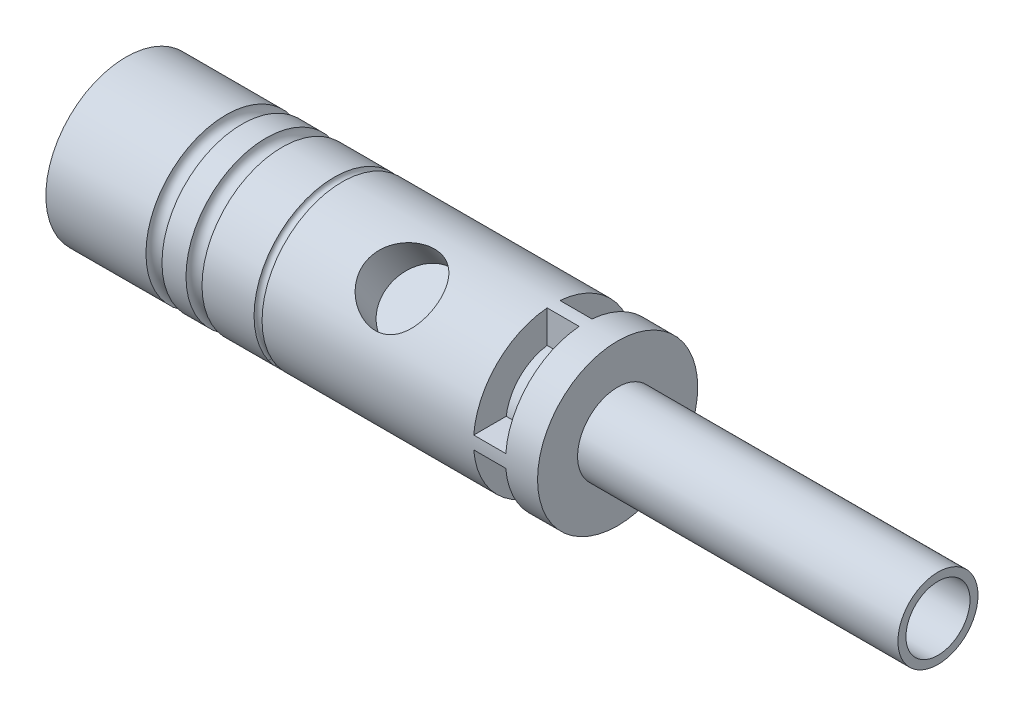
from build123d import *

# Parameters (mm, degrees)
SKETCH1_R           = 12.7
BOSS_EXTRUDE1_DEPTH = 38.989
SKETCH2_R           = 6.35
BOSS_EXTRUDE2_DEPTH = 50.8
SKETCH5_R           = 5.08
CUT_EXTRUDE1_DEPTH  = 50.8
SKETCH6_R           = 11.938
CUT_EXTRUDE2_DEPTH  = 11.684
SKETCH7_R           = 1.27
BOSS_EXTRUDE4_DEPTH = 6.35
SKETCH10_R          = 5.715
CUT_EXTRUDE3_DEPTH  = 7.62
SKETCH11_R          = 2.306564876
CUT_EXTRUDE4_DEPTH  = 92.567704602
CUT_EXTRUDE5_DEPTH  = 5.08
CIRPATTERN1_COUNT   = 4
SKETCH14_R          = 1.27
SKETCH14_R_2        = 0.635


with BuildPart() as part:
    # Sketch1 → Boss-Extrude1 (new, symmetric)
    with BuildSketch(Plane(origin=(0, 0, 0), x_dir=(0, 0, -1), z_dir=(1, 0, 0))):
        Circle(SKETCH1_R)
    extrude(amount=BOSS_EXTRUDE1_DEPTH, both=True)

    # Sketch2 → Boss-Extrude2 (add)
    with BuildSketch(Plane(origin=(38.989, 0, 0), x_dir=(0, 0, -1), z_dir=(1, 0, 0))):
        Circle(SKETCH2_R)
    extrude(amount=BOSS_EXTRUDE2_DEPTH)

    # Sketch5 → Cut-Extrude1 (cut)
    with BuildSketch(Plane(origin=(89.789, 0, 0), x_dir=(0, 0, -1), z_dir=(1, 0, 0))):
        Circle(SKETCH5_R)
    extrude(amount=-CUT_EXTRUDE1_DEPTH, mode=Mode.SUBTRACT)

    # Sketch6 → Cut-Extrude2 (cut)
    with BuildSketch(Plane.ZY.offset(38.989)):
        Circle(SKETCH6_R)
    extrude(amount=-CUT_EXTRUDE2_DEPTH, mode=Mode.SUBTRACT)

    # Sketch7 → Boss-Extrude4 (add)
    with BuildSketch(Plane.ZY.offset(27.305)):
        Circle(SKETCH7_R)
    extrude(amount=BOSS_EXTRUDE4_DEPTH)

    # Sketch10 → Cut-Extrude3 (cut)
    with BuildSketch(Plane(origin=(0, 11.528802792, 8.001614114), x_dir=(1, 0, 0), z_dir=(0, 0.8215201333891482, 0.5701795072047716))):
        with Locations(Location((11.73200505, 0, 0), (0, 0, 270))):
            Circle(SKETCH10_R)
    extrude(amount=-CUT_EXTRUDE3_DEPTH, mode=Mode.SUBTRACT)

    # Sketch11 → Cut-Extrude4 (cut, through all)
    with BuildSketch(Plane(origin=(0, 0, 0), x_dir=(1, 0, 0), z_dir=(0, -0.5701795072047716, 0.8215201333891482))):
        with Locations(Location((16.023991034, 0, 0), (0, 0, 270))):
            Circle(SKETCH11_R)
        with Locations(Location((-9.873377059, 0, 0), (0, 0, 270))):
            Circle(SKETCH11_R)
    extrude(amount=-CUT_EXTRUDE4_DEPTH, mode=Mode.SUBTRACT)

    # Sketch13 → Cut-Extrude5 (cut)
    with BuildSketch(Plane(origin=(33.909, 0, 0), x_dir=(0, 0, -1), z_dir=(1, 0, 0))):
        with BuildLine():
            Line((1.016, 7.50672894), (1.016, 13.505826979))
            ThreePointArc((1.016, 13.505826979), (9.577045953, 9.577045953), (13.505826979, 1.016))
            Line((13.505826979, 1.016), (7.50672894, 1.016))
            ThreePointArc((7.50672894, 1.016), (5.356455702, 5.356455702), (1.016, 7.50672894))
        make_face()
    cut_extrude5 = extrude(amount=-CUT_EXTRUDE5_DEPTH, mode=Mode.SUBTRACT)

    # CirPattern1: Cut-Extrude5 ×4 about axis
    cirpattern1_axis = Axis((0, 0, 0), (1, 0, 0))
    for i in range(1, CIRPATTERN1_COUNT):
        add(cut_extrude5.rotate(cirpattern1_axis, i * 360 / CIRPATTERN1_COUNT), mode=Mode.SUBTRACT)

    # Sketch14 → Cut-Revolve1 (revolve, cut)
    with BuildSketch(Plane.XY, mode=Mode.PRIVATE) as cut_revolve1_sk:
        with Locations((-21.844, 12.7)):
            Circle(SKETCH14_R)
        with Locations((-15.494, 12.7)):
            Circle(SKETCH14_R)
        with Locations((-5.334, 12.7)):
            Circle(SKETCH14_R_2)
    revolve(cut_revolve1_sk.sketch.rotate(Axis((-39.034342582, 0, 0), (1, 0, 0)), 90), axis=Axis((-39.034342582, 0, 0), (1, 0, 0)), mode=Mode.SUBTRACT)


solid = part.part
